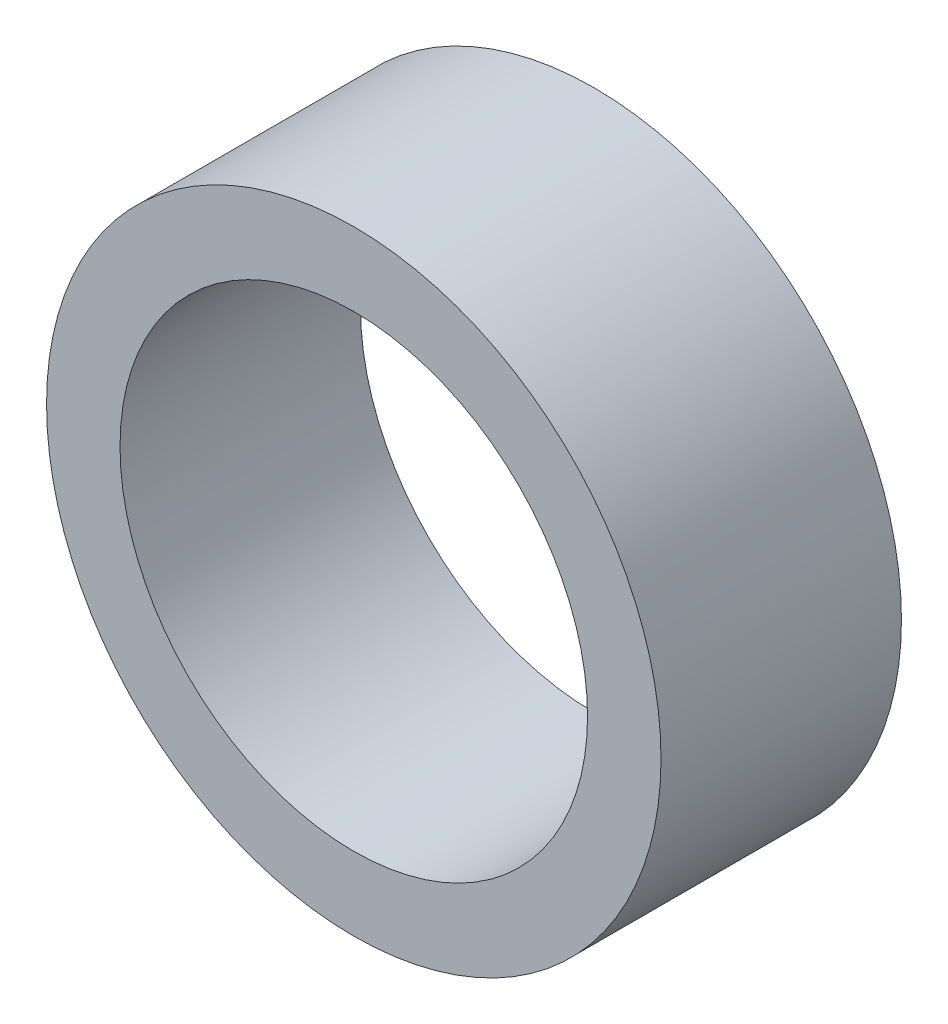
from build123d import *

# Parameters (mm, degrees)
SKETCH_1_R      = 11.5
SKETCH_1_R_2    = 8.75
EXTRUDE_1_DEPTH = 9


with BuildPart() as part:
    # 草图1 → 凸台-拉伸1 (new body)
    with BuildSketch(Plane.XY):
        Circle(SKETCH_1_R)
        Circle(SKETCH_1_R_2, mode=Mode.SUBTRACT)
    extrude(amount=EXTRUDE_1_DEPTH)


solid = part.part
